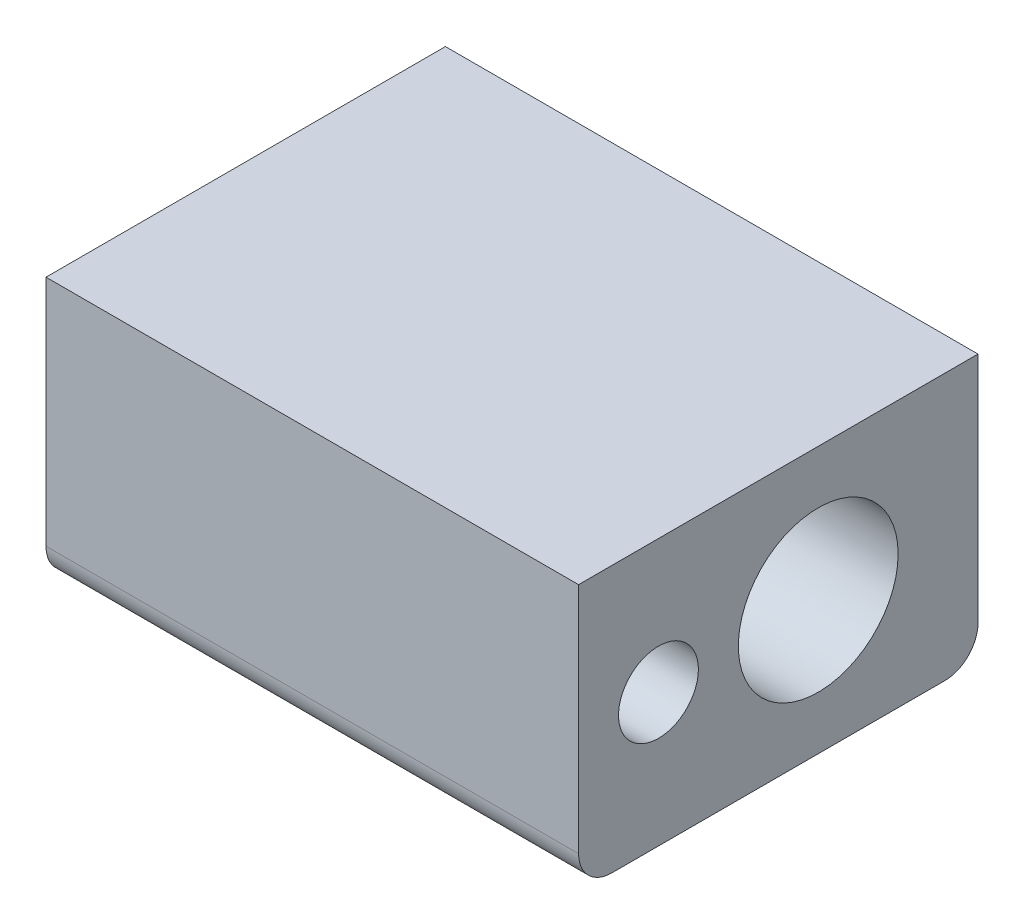
from build123d import *

# Parameters (mm, degrees)
SKETCH1_W           = 50.8
SKETCH1_H           = 76.2
SKETCH1_R           = 15.24
SKETCH1_R_2         = 7.62
BOSS_EXTRUDE1_DEPTH = 101.6
FILLET1_R           = 6.35


with BuildPart() as part:
    # Sketch1 → Boss-Extrude1 (new body)
    with BuildSketch(Plane.YZ):
        Rectangle(SKETCH1_W, SKETCH1_H)
        with Locations(Location((0, -7.62, 0), (0, 0, 270))):
            Circle(SKETCH1_R, mode=Mode.SUBTRACT)
        with Locations(Location((0, 22.86, 0), (0, 0, 270))):
            Circle(SKETCH1_R_2, mode=Mode.SUBTRACT)
    extrude(amount=BOSS_EXTRUDE1_DEPTH)

    # Fillet1
    fillet1_edges = [part.edges().sort_by_distance(p)[0] for p in [
        (50.8, -25.4, 38.1),
        (50.8, -25.4, -38.1),
    ]]
    fillet(fillet1_edges, radius=FILLET1_R)


solid = part.part
